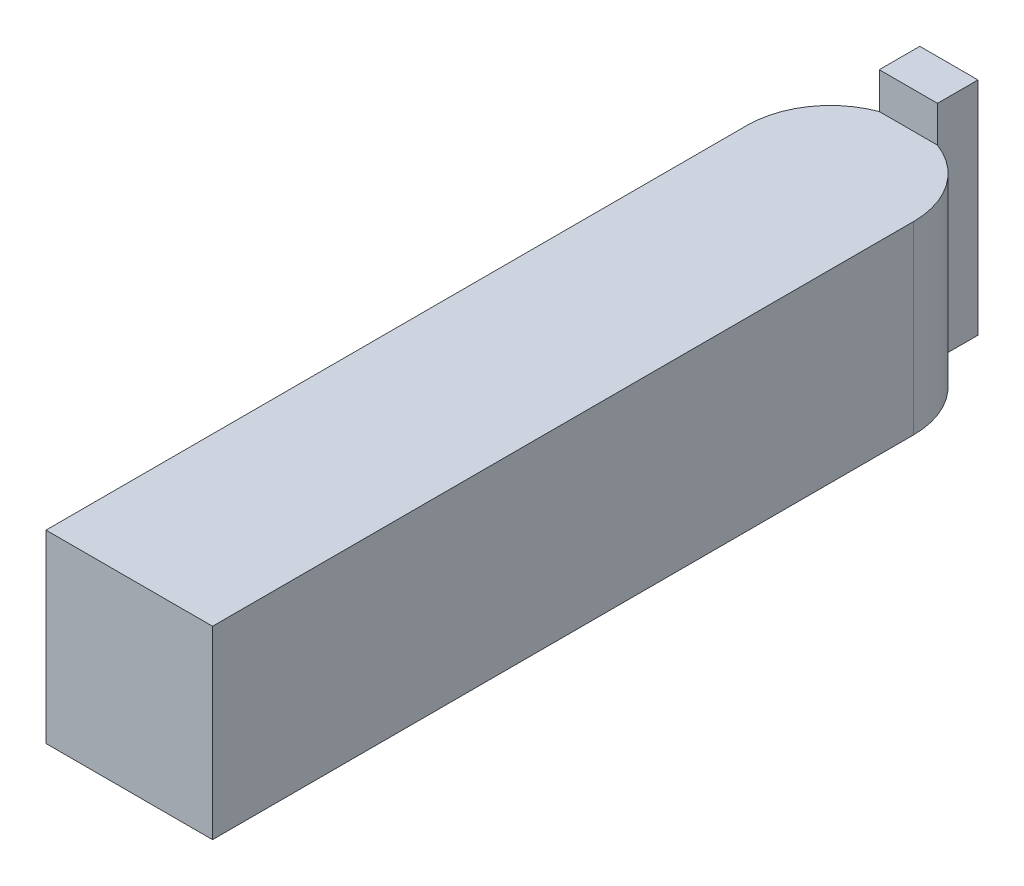
from build123d import *

# Parameters (mm, degrees)
BOSS_EXTRUDE1_DEPTH = 36.5125
SKETCH2_W           = 11.5
SKETCH2_H           = 8
BOSS_EXTRUDE2_DEPTH = 7.16


with BuildPart() as part:
    # Sketch1 → Boss-Extrude1 (new body)
    with BuildSketch(Plane(origin=(0, 0, 0), x_dir=(1, 0, 0), z_dir=(0, 1, 0))):
        with BuildLine():
            Line((-16.45, -69.245), (16.45, -69.245))
            Line((16.45, -69.245), (16.45, 69.245))
            ThreePointArc((16.45, 69.245), (13.512771736, 78.626231262), (5.75, 84.657332724))
            Line((5.75, 84.657332724), (5.75, 92.657332724))
            Line((5.75, 92.657332724), (-5.75, 92.657332724))
            Line((-5.75, 92.657332724), (-5.75, 84.657332724))
            ThreePointArc((-5.75, 84.657332724), (-13.512771736, 78.626231262), (-16.45, 69.245))
            Line((-16.45, 69.245), (-16.45, -69.245))
        make_face()
    extrude(amount=BOSS_EXTRUDE1_DEPTH)

    # Sketch2 → Boss-Extrude2 (add)
    with BuildSketch(Plane(origin=(0, 36.5125, 0), x_dir=(1, 0, 0), z_dir=(0, 1, 0))):
        with Locations((0, 88.657332724)):
            Rectangle(SKETCH2_W, SKETCH2_H)
    extrude(amount=BOSS_EXTRUDE2_DEPTH)


solid = part.part
